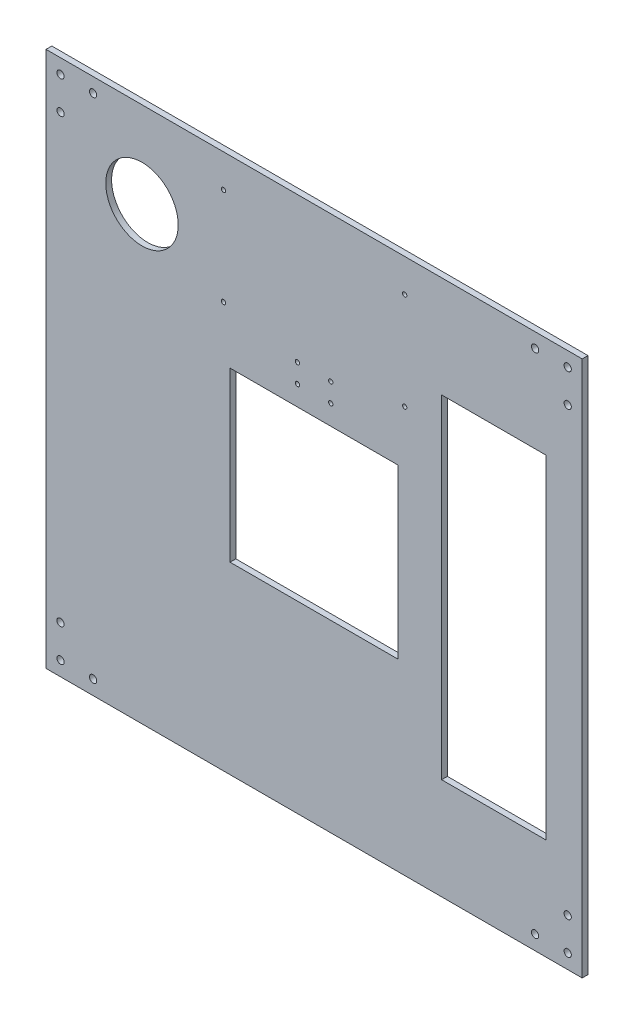
from build123d import *

# Parameters (mm, degrees)
SKETCH_1_W           = 370
SKETCH_1_H           = 370
EXTRUDE_1_DEPTH      = 4
SKETCH_2_R           = 2.5
CUT_EXTRUDE_1_DEPTH  = 262.660084843
SKETCH_6_R           = 1.5
CUT_EXTRUDE_7_DEPTH  = 262.660084843
SKETCH_7_R           = 25
CUT_EXTRUDE_8_DEPTH  = 262.660084843
SKETCH_8_W           = 116
SKETCH_8_H           = 116
CUT_EXTRUDE_9_DEPTH  = 10
SKETCH_11_W          = 72
SKETCH_11_H          = 230
CUT_EXTRUDE_11_DEPTH = 5
SKETCH_12_R          = 1.5
CUT_EXTRUDE_12_DEPTH = 262.660084843


with BuildPart() as part:
    # 草图1 → 凸台-拉伸1 (new body)
    with BuildSketch(Plane.XY):
        Rectangle(SKETCH_1_W, SKETCH_1_H)
    extrude(amount=EXTRUDE_1_DEPTH)

    # 草图2 → 切除-拉伸1 (cut, through all)
    with BuildSketch(Plane.XY.offset(4)):
        with Locations((-175, -175)):
            Circle(SKETCH_2_R)
        with Locations((-152.5, -175)):
            Circle(SKETCH_2_R)
        with Locations((-175, -152.5)):
            Circle(SKETCH_2_R)
        with Locations((-152.5, 175)):
            Circle(SKETCH_2_R)
        with Locations((-175, 152.5)):
            Circle(SKETCH_2_R)
        with Locations((-175, 175)):
            Circle(SKETCH_2_R)
        with Locations((175, 152.5)):
            Circle(SKETCH_2_R)
        with Locations((152.5, 175)):
            Circle(SKETCH_2_R)
        with Locations((175, 175)):
            Circle(SKETCH_2_R)
        with Locations((152.5, -175)):
            Circle(SKETCH_2_R)
        with Locations((175, -152.5)):
            Circle(SKETCH_2_R)
        with Locations((175, -175)):
            Circle(SKETCH_2_R)
    extrude(amount=-CUT_EXTRUDE_1_DEPTH, mode=Mode.SUBTRACT)

    # 草图6 → 切除-拉伸7 (cut, through all)
    with BuildSketch(Plane(origin=(0, 0, 0), x_dir=(-1, 0, 0), z_dir=(0, 0, -1))):
        with Locations((-62.5, 162.249795252)):
            Circle(SKETCH_6_R)
        with Locations((-62.5, 95.249795252)):
            Circle(SKETCH_6_R)
        with Locations((62.5, 95.249795252)):
            Circle(SKETCH_6_R)
        with Locations((62.5, 162.249795252)):
            Circle(SKETCH_6_R)
    extrude(amount=-CUT_EXTRUDE_7_DEPTH, mode=Mode.SUBTRACT)

    # 草图7 → 切除-拉伸8 (cut, through all)
    with BuildSketch(Plane(origin=(0, 0, 0), x_dir=(-1, 0, 0), z_dir=(0, 0, -1))):
        with Locations((118.769854949, 125.631801741)):
            Circle(SKETCH_7_R)
    extrude(amount=-CUT_EXTRUDE_8_DEPTH, mode=Mode.SUBTRACT)

    # 草图8 → 切除-拉伸9 (cut)
    with BuildSketch(Plane(origin=(0, 0, 0), x_dir=(-1, 0, 0), z_dir=(0, 0, -1))):
        Rectangle(SKETCH_8_W, SKETCH_8_H)
    extrude(amount=-CUT_EXTRUDE_9_DEPTH, mode=Mode.SUBTRACT)

    # 草图11 → 切除-拉伸11 (cut)
    with BuildSketch(Plane(origin=(0, 0, 0), x_dir=(-1, 0, 0), z_dir=(0, 0, -1))):
        with Locations((-124, 0)):
            Rectangle(SKETCH_11_W, SKETCH_11_H)
    extrude(amount=-CUT_EXTRUDE_11_DEPTH, mode=Mode.SUBTRACT)

    # 草图12 → 切除-拉伸12 (cut, through all)
    with BuildSketch(Plane(origin=(0, 0, 0), x_dir=(-1, 0, 0), z_dir=(0, 0, -1))):
        with Locations((-11.5, 71.732050808)):
            Circle(SKETCH_12_R)
        with Locations((11.5, 71.732050808)):
            Circle(SKETCH_12_R)
        with Locations((-11.5, 84.732050808)):
            Circle(SKETCH_12_R)
        with Locations((11.5, 84.732050808)):
            Circle(SKETCH_12_R)
    extrude(amount=-CUT_EXTRUDE_12_DEPTH, mode=Mode.SUBTRACT)


solid = part.part
